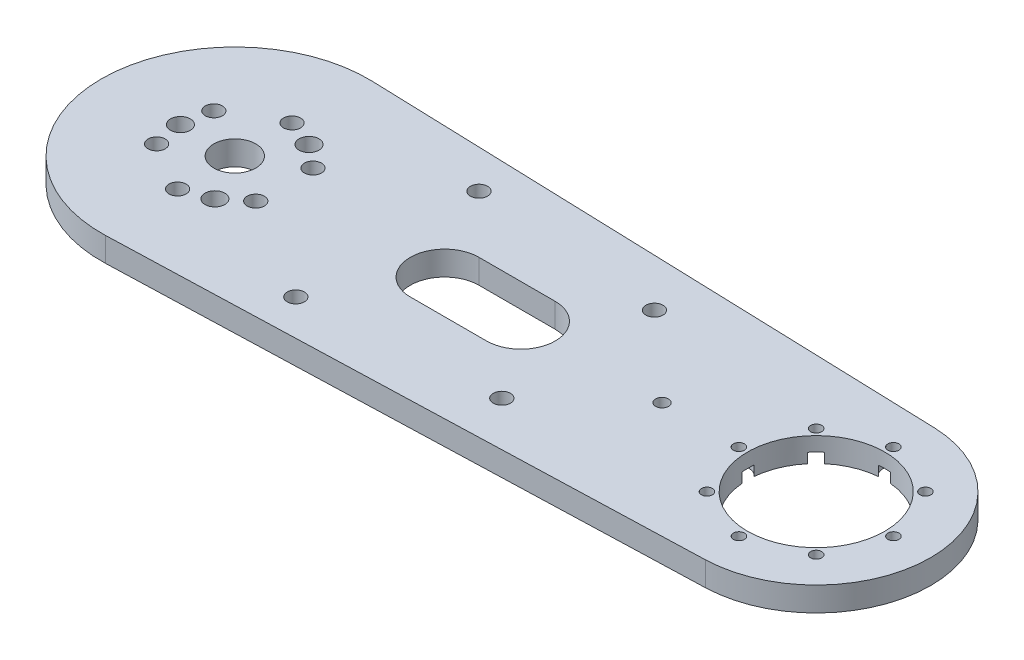
from build123d import *

# Parameters (mm, degrees)
PLACA_START                     = 4
PLACA_DEPTH                     = 6.35
PLACA_R1_START                  = 4
CROQUIS14_R                     = 35
PLACA_R1_DEPTH                  = 6.35
PLACA_R2_START                  = 4
CROQUIS15_R                     = 30
PLACA_R2_DEPTH                  = 6.35
ALIGERADO_START                 = 4
ALIGERADO_DEPTH                 = 6.35
BARRENOS_SEPARADORES_M4_START   = 4
CROQUIS17_R                     = 2.25
BARRENOS_SEPARADORES_M4_DEPTH   = 6.35
BARRENOS_M2_Y_M3_START          = 4
CROQUIS18_R                     = 2.25
CROQUIS18_R_2                   = 2.6
CROQUIS18_R_3                   = 5.5
CROQUIS18_R_4                   = 18
CROQUIS18_R_5                   = 1.45
BARRENOS_M2_Y_M3_DEPTH          = 6.35
REFRENTADO_M4_CABEZA_BAJA_START = 4
CROQUIS19_R                     = 4
REFRENTADO_M4_CABEZA_BAJA_DEPTH = 2.8
REFRENTADO_M2_5_START           = 4
CROQUIS20_R                     = 2.8
REFRENTADO_M2_5_DEPTH           = 2.6
ROSCA_M3_BASES_CINCHO_START     = 4
CROQUIS21_R                     = 1.25
ROSCA_M3_BASES_CINCHO_DEPTH     = 6.35
PASO_M3_BASES_CINCHO_START      = 4
CROQUIS22_R                     = 1.7
PASO_M3_BASES_CINCHO_DEPTH      = 6.35


with BuildPart() as part:
    # Croquis13 → Placa (new body)
    with BuildSketch(Plane(origin=(0, 0, 0), x_dir=(1, 0, 0), z_dir=(0, 1, 0)).offset(PLACA_START)):
        Polygon((1.148293963, -206.431158085), (153.384251969, -201.433849787), (153.384251969, -141.466150213), (1.148293963, -136.468841915), align=None)
    extrude(amount=PLACA_DEPTH)

    # Croquis14 → Placa_r1 (add)
    with BuildSketch(Plane(origin=(0, 0, 0), x_dir=(1, 0, 0), z_dir=(0, 1, 0)).offset(PLACA_R1_START)):
        with Locations((0, -171.45)):
            Circle(CROQUIS14_R)
    extrude(amount=PLACA_R1_DEPTH)

    # Croquis15 → Placa_r2 (add)
    with BuildSketch(Plane(origin=(0, 0, 0), x_dir=(1, 0, 0), z_dir=(0, 1, 0)).offset(PLACA_R2_START)):
        with Locations((152.4, -171.45)):
            Circle(CROQUIS15_R)
    extrude(amount=PLACA_R2_DEPTH)

    # Croquis16 → Aligerado (cut)
    with BuildSketch(Plane(origin=(0, 0, 0), x_dir=(1, 0, 0), z_dir=(0, 1, 0)).offset(ALIGERADO_START)):
        with BuildLine():
            Line((55, -162.45), (75, -162.45))
            ThreePointArc((75, -162.45), (84, -171.45), (75, -180.45))
            Line((75, -180.45), (55, -180.45))
            ThreePointArc((55, -180.45), (46, -171.45), (55, -162.45))
        make_face()
    extrude(amount=ALIGERADO_DEPTH, mode=Mode.SUBTRACT)

    # Croquis17 → Barrenos_separadores_M4 (cut)
    with BuildSketch(Plane(origin=(0, 0, 0), x_dir=(1, 0, 0), z_dir=(0, 1, 0)).offset(BARRENOS_SEPARADORES_M4_START)):
        with Locations((40, -195.45)):
            Circle(CROQUIS17_R)
        with Locations((40, -147.45)):
            Circle(CROQUIS17_R)
        with Locations((90, -191.45)):
            Circle(CROQUIS17_R)
        with Locations((90, -151.45)):
            Circle(CROQUIS17_R)
    extrude(amount=BARRENOS_SEPARADORES_M4_DEPTH, mode=Mode.SUBTRACT)

    # Croquis18 → Barrenos_M2_y_M3 (cut)
    with BuildSketch(Plane(origin=(0, 0, 0), x_dir=(1, 0, 0), z_dir=(0, 1, 0)).offset(BARRENOS_M2_Y_M3_START)):
        with Locations((12.990381057, -178.95)):
            Circle(CROQUIS18_R)
        with Locations((0, -186.45)):
            Circle(CROQUIS18_R)
        with Locations((-12.990381057, -178.95)):
            Circle(CROQUIS18_R)
        with Locations((-12.990381057, -163.95)):
            Circle(CROQUIS18_R)
        with Locations((0, -156.45)):
            Circle(CROQUIS18_R)
        with Locations((12.990381057, -163.95)):
            Circle(CROQUIS18_R)
        with Locations((7.125, -183.790862004)):
            Circle(CROQUIS18_R_2)
        with Locations((-14.25, -171.45)):
            Circle(CROQUIS18_R_2)
        with Locations((7.125, -159.109137996)):
            Circle(CROQUIS18_R_2)
        with Locations((0, -171.45)):
            Circle(CROQUIS18_R_3)
        with Locations((152.4, -171.45)):
            Circle(CROQUIS18_R_4)
        with Locations((172.65, -171.45)):
            Circle(CROQUIS18_R_5)
        with Locations((166.718912319, -185.768912319)):
            Circle(CROQUIS18_R_5)
        with Locations((152.4, -191.7)):
            Circle(CROQUIS18_R_5)
        with Locations((138.081087681, -185.768912319)):
            Circle(CROQUIS18_R_5)
        with Locations((132.15, -171.45)):
            Circle(CROQUIS18_R_5)
        with Locations((138.081087681, -157.131087681)):
            Circle(CROQUIS18_R_5)
        with Locations((152.4, -151.2)):
            Circle(CROQUIS18_R_5)
        with Locations((166.718912319, -157.131087681)):
            Circle(CROQUIS18_R_5)
    extrude(amount=BARRENOS_M2_Y_M3_DEPTH, mode=Mode.SUBTRACT)

    # Croquis19 → Refrentado_M4_cabeza_baja (cut)
    with BuildSketch(Plane(origin=(0, 0, 0), x_dir=(1, 0, 0), z_dir=(0, 1, 0)).offset(REFRENTADO_M4_CABEZA_BAJA_START)):
        with Locations((12.990381057, -178.95)):
            Circle(CROQUIS19_R)
        with Locations((0, -186.45)):
            Circle(CROQUIS19_R)
        with Locations((-12.990381057, -178.95)):
            Circle(CROQUIS19_R)
        with Locations((-12.990381057, -163.95)):
            Circle(CROQUIS19_R)
        with Locations((0, -156.45)):
            Circle(CROQUIS19_R)
        with Locations((12.990381057, -163.95)):
            Circle(CROQUIS19_R)
    extrude(amount=REFRENTADO_M4_CABEZA_BAJA_DEPTH, mode=Mode.SUBTRACT)

    # Croquis20 → Refrentado_M2-5 (cut)
    with BuildSketch(Plane(origin=(0, 0, 0), x_dir=(1, 0, 0), z_dir=(0, 1, 0)).offset(REFRENTADO_M2_5_START)):
        with Locations((172.65, -171.45)):
            Circle(CROQUIS20_R)
        with Locations((166.718912319, -185.768912319)):
            Circle(CROQUIS20_R)
        with Locations((152.4, -191.7)):
            Circle(CROQUIS20_R)
        with Locations((138.081087681, -185.768912319)):
            Circle(CROQUIS20_R)
        with Locations((132.15, -171.45)):
            Circle(CROQUIS20_R)
        with Locations((138.081087681, -157.131087681)):
            Circle(CROQUIS20_R)
        with Locations((152.4, -151.2)):
            Circle(CROQUIS20_R)
        with Locations((166.718912319, -157.131087681)):
            Circle(CROQUIS20_R)
    extrude(amount=REFRENTADO_M2_5_DEPTH, mode=Mode.SUBTRACT)

    # Croquis21 → Rosca_M3_bases_cincho (cut)
    with BuildSketch(Plane(origin=(0, 0, 0), x_dir=(1, 0, 0), z_dir=(0, 1, 0)).offset(ROSCA_M3_BASES_CINCHO_START)):
        with Locations((112, -171.45)):
            Circle(CROQUIS21_R)
    extrude(amount=ROSCA_M3_BASES_CINCHO_DEPTH, mode=Mode.SUBTRACT)

    # Croquis22 → Paso_M3_bases_cincho (cut)
    with BuildSketch(Plane(origin=(0, 0, 0), x_dir=(1, 0, 0), z_dir=(0, 1, 0)).offset(PASO_M3_BASES_CINCHO_START)):
        with Locations((112, -171.45)):
            Circle(CROQUIS22_R)
    extrude(amount=PASO_M3_BASES_CINCHO_DEPTH, mode=Mode.SUBTRACT)


solid = part.part
